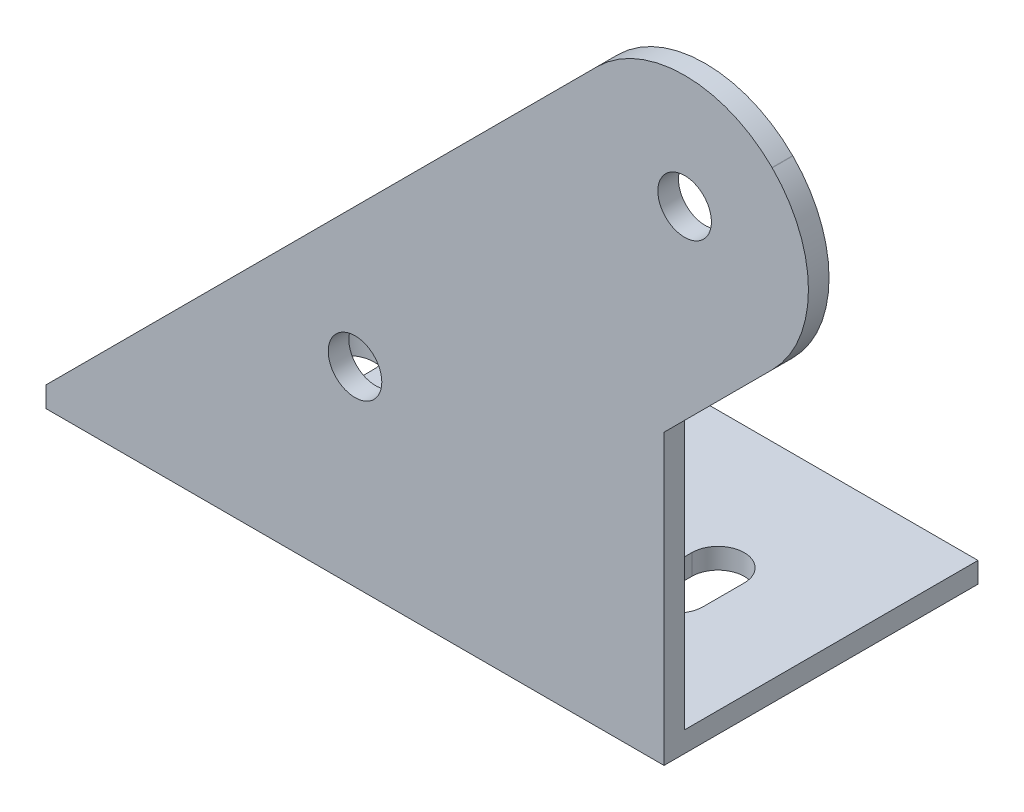
from build123d import *

# Parameters (mm, degrees)
CROQUIS1_R              = 6.5
SALIENTE_EXTRUIR1_DEPTH = 5
CROQUIS2_W              = 150
CROQUIS2_H              = 76.2
SALIENTE_EXTRUIR2_DEPTH = 5
CROQUIS3_R              = 6.5
CROQUIS3_R_2            = 10
SALIENTE_EXTRUIR3_DEPTH = 5


with BuildPart() as part:
    # Croquis1 → Saliente-Extruir1 (new body)
    with BuildSketch(Plane.XY):
        with BuildLine():
            Line((75, 0), (-75, 0))
            Line((-75, 0), (-21.213203436, 53.786796564))
            ThreePointArc((-21.213203436, 53.786796564), (0, 62.573593129), (21.213203436, 53.786796564))
            Line((21.213203436, 53.786796564), (75, 0))
        make_face()
        with Locations((0, 41.325890401)):
            Circle(CROQUIS1_R, mode=Mode.SUBTRACT)
    extrude(amount=SALIENTE_EXTRUIR1_DEPTH)

    # Croquis2 → Saliente-Extruir2 (add)
    with BuildSketch(Plane.XZ):
        with Locations((0, -33.1)):
            Rectangle(CROQUIS2_W, CROQUIS2_H)
        with BuildLine():
            Line((-38.481595315, -28.1), (-38.481595315, -38.1))
            ThreePointArc((-38.481595315, -38.1), (-45, -44.618404685), (-51.518404685, -38.1))
            Line((-51.518404685, -38.1), (-51.518404685, -28.1))
            ThreePointArc((-51.518404685, -28.1), (-45, -21.581595315), (-38.481595315, -28.1))
        make_face(mode=Mode.SUBTRACT)
        with BuildLine():
            Line((51.37253144, -28.1), (51.37253144, -38.1))
            ThreePointArc((51.37253144, -38.1), (45, -44.47253144), (38.62746856, -38.1))
            Line((38.62746856, -38.1), (38.62746856, -28.1))
            ThreePointArc((38.62746856, -28.1), (45, -21.72746856), (51.37253144, -28.1))
        make_face(mode=Mode.SUBTRACT)
    extrude(amount=SALIENTE_EXTRUIR2_DEPTH)

    # Croquis3 → Saliente-Extruir3 (add)
    with BuildSketch(Plane(origin=(0, 0, 0), x_dir=(-1, 0, 0), z_dir=(0, 0, -1))):
        with BuildLine():
            Line((75, 0), (-58.786796564, 133.786796564))
            ThreePointArc((-58.786796564, 133.786796564), (-80, 142.573593129), (-101.213203436, 133.786796564))
            Line((-101.213203436, 133.786796564), (-101.263160567, 133.736839433))
            ThreePointArc((-101.263160567, 133.736839433), (-110.049957131, 112.523635998), (-101.263160567, 91.310432562))
            Line((-101.263160567, 91.310432562), (-75, 65.047271996))
            Line((-75, 65.047271996), (-75, 0))
            Line((-75, 0), (75, 0))
        make_face()
        with Locations((-80, 115)):
            Circle(CROQUIS3_R, mode=Mode.SUBTRACT)
        with Locations((0, 41.325890401)):
            Circle(CROQUIS3_R_2, mode=Mode.SUBTRACT)
    extrude(amount=-SALIENTE_EXTRUIR3_DEPTH)


solid = part.part
